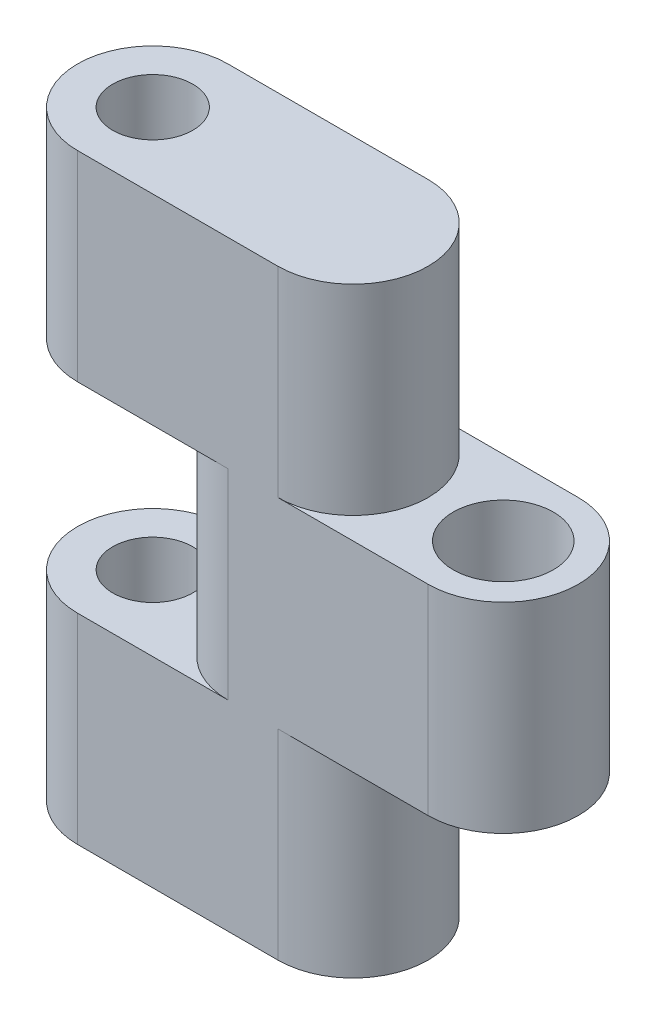
from build123d import *

# Parameters (mm, degrees)
SKETCH_2_R               = 0.8
SKETCH_2_R_2             = 1
EXTRUDE_1_DEPTH          = 12
CUT_EXTRUDE_1_DEPTH      = 4
CUT_EXTRUDE_2_DEPTH      = 2
CUT_EXTRUDE_2_DEPTH_BACK = 2


with BuildPart() as part:
    # 草图2 → 凸台-拉伸1 (new body)
    with BuildSketch(Plane(origin=(0, 0, 0), x_dir=(1, 0, 0), z_dir=(0, 1, 0))):
        with BuildLine():
            Line((0, 0), (7, 0))
            ThreePointArc((7, 0), (8.5, -1.5), (7, -3))
            Line((7, -3), (0, -3))
            ThreePointArc((0, -3), (-1.5, -1.5), (0, 0))
        make_face()
        with Locations(Location((0, -1.5, 0), (0, 0, 270))):
            Circle(SKETCH_2_R, mode=Mode.SUBTRACT)
        with Locations(Location((7, -1.5, 0), (0, 0, 270))):
            Circle(SKETCH_2_R_2, mode=Mode.SUBTRACT)
    extrude(amount=EXTRUDE_1_DEPTH)

    # 草图4 → 切除-拉伸1 (cut)
    with BuildSketch(Plane.XZ):
        with BuildLine():
            Line((7, 0), (4, 0))
            ThreePointArc((4, 0), (5.5, 1.5), (4, 3))
            Line((4, 3), (7, 3))
            ThreePointArc((7, 3), (8.5, 1.5), (7, 0))
        make_face()
    cut_extrude_1 = extrude(amount=-CUT_EXTRUDE_1_DEPTH, mode=Mode.SUBTRACT)

    # 镜向1: 切除-拉伸1 across plane
    add(cut_extrude_1.mirror(Plane(origin=(0, 6, 0), x_dir=(0, 0, 1), z_dir=(0, -1, 0))), mode=Mode.SUBTRACT)

    # 草图5 → 切除-拉伸2 (cut, two sides: drawn at the far end of the back side and taken through both)
    with BuildSketch(Plane.XZ.offset(-6).offset(-CUT_EXTRUDE_2_DEPTH_BACK)):
        with BuildLine():
            Line((0, 3), (3, 3))
            ThreePointArc((3, 3), (1.5, 1.5), (3, 0))
            Line((3, 0), (0, 0))
            ThreePointArc((0, 0), (-1.5, 1.5), (0, 3))
        make_face()
    extrude(amount=CUT_EXTRUDE_2_DEPTH + CUT_EXTRUDE_2_DEPTH_BACK, mode=Mode.SUBTRACT)


solid = part.part
